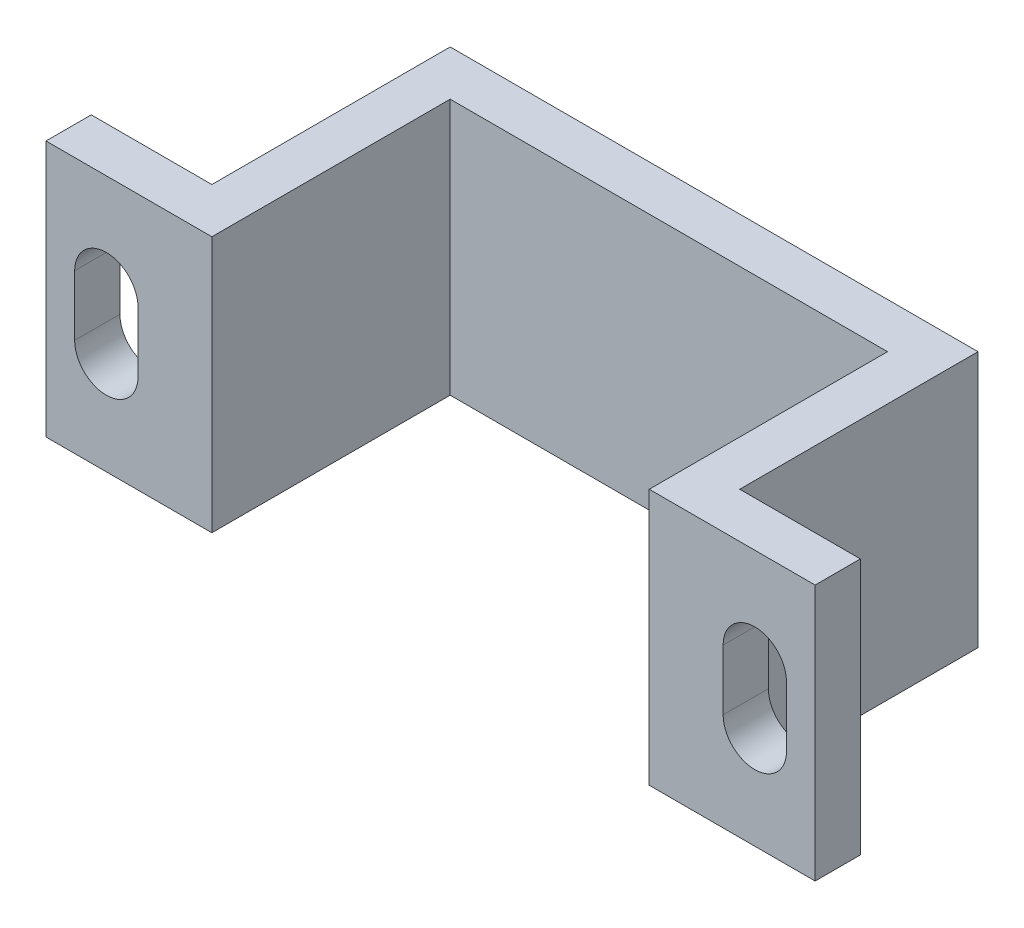
from build123d import *

# Parameters (mm, degrees)
BASE_DEPTH     = 21.59
BOLTHOLE_REACH = 45.79


with BuildPart() as part:
    # Sketch4 → base (new body)
    with BuildSketch(Plane(origin=(0, 0, 0), x_dir=(1, 0, 0), z_dir=(0, 1, 0))):
        Polygon((0, 0), (13.97, 0), (13.97, 20.066), (32.385, 20.066), (32.385, 23.876), (10.16, 23.876), (10.16, 3.81), (0, 3.81), align=None)
    base = extrude(amount=BASE_DEPTH)

    # Sketch5 → bolthole (cut, up to next)
    with BuildSketch(Plane(origin=(0, 0, -3.81), x_dir=(-1, 0, 0), z_dir=(0, 0, -1)), mode=Mode.PRIVATE) as bolthole_sk1:
        with BuildLine():
            Line((-2.413, 13.335), (-2.413, 8.255))
            ThreePointArc((-2.413, 8.255), (-5.08, 5.588), (-7.747, 8.255))
            Line((-7.747, 8.255), (-7.747, 13.335))
            ThreePointArc((-7.747, 13.335), (-5.08, 16.002), (-2.413, 13.335))
        make_face()
    bolthole_tool1 = extrude(bolthole_sk1.sketch, amount=-BOLTHOLE_REACH, mode=Mode.PRIVATE) & part.part
    bolthole = bolthole_tool1.solids().sort_by_distance((5.08, 10.795, -3.81))[0]
    add(bolthole, mode=Mode.SUBTRACT)

    # Mirror1: base, bolthole across plane
    add(base.mirror(Plane(origin=(32.385, 21.59, -20.066), x_dir=(0, 0, 1), z_dir=(-1, 0, 0))))
    add(bolthole.mirror(Plane(origin=(32.385, 21.59, -20.066), x_dir=(0, 0, 1), z_dir=(-1, 0, 0))), mode=Mode.SUBTRACT)


solid = part.part
